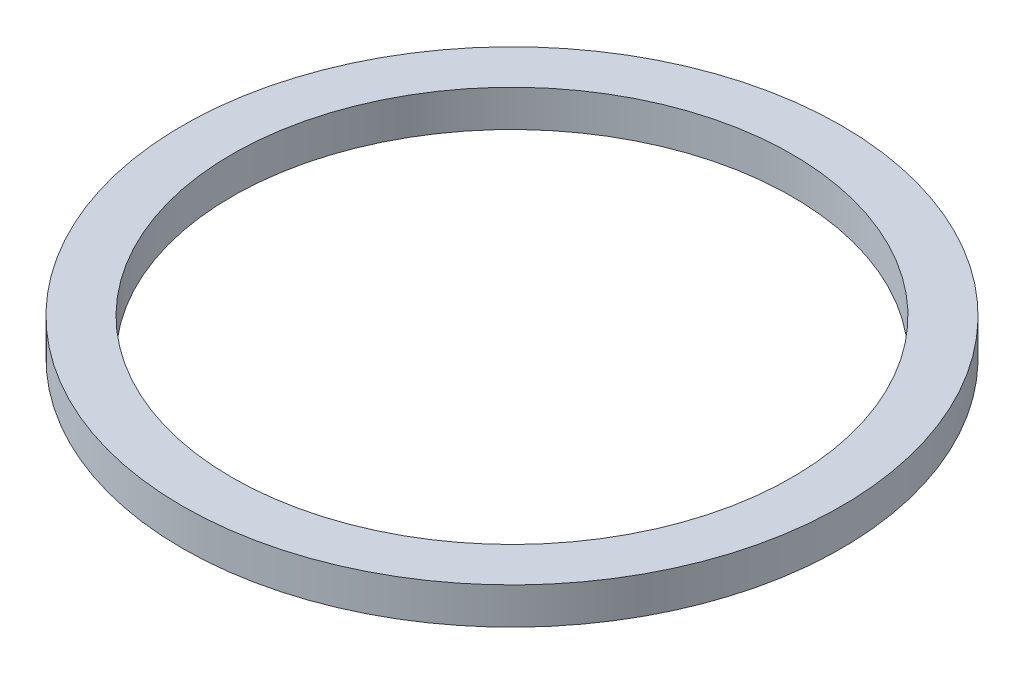
from build123d import *

# Parameters (mm, degrees)
SKETCH1_R           = 15.3
SKETCH1_R_2         = 13
BOSS_EXTRUDE1_DEPTH = 1.7


with BuildPart() as part:
    # Sketch1 → Boss-Extrude1 (new body)
    with BuildSketch(Plane(origin=(0, 0, 0), x_dir=(1, 0, 0), z_dir=(0, 1, 0))):
        with Locations(Location((0, 0, 0), (0, 0, 270))):
            Circle(SKETCH1_R)
        with Locations(Location((0, 0, 0), (0, 0, 270))):
            Circle(SKETCH1_R_2, mode=Mode.SUBTRACT)
    extrude(amount=BOSS_EXTRUDE1_DEPTH)


solid = part.part
